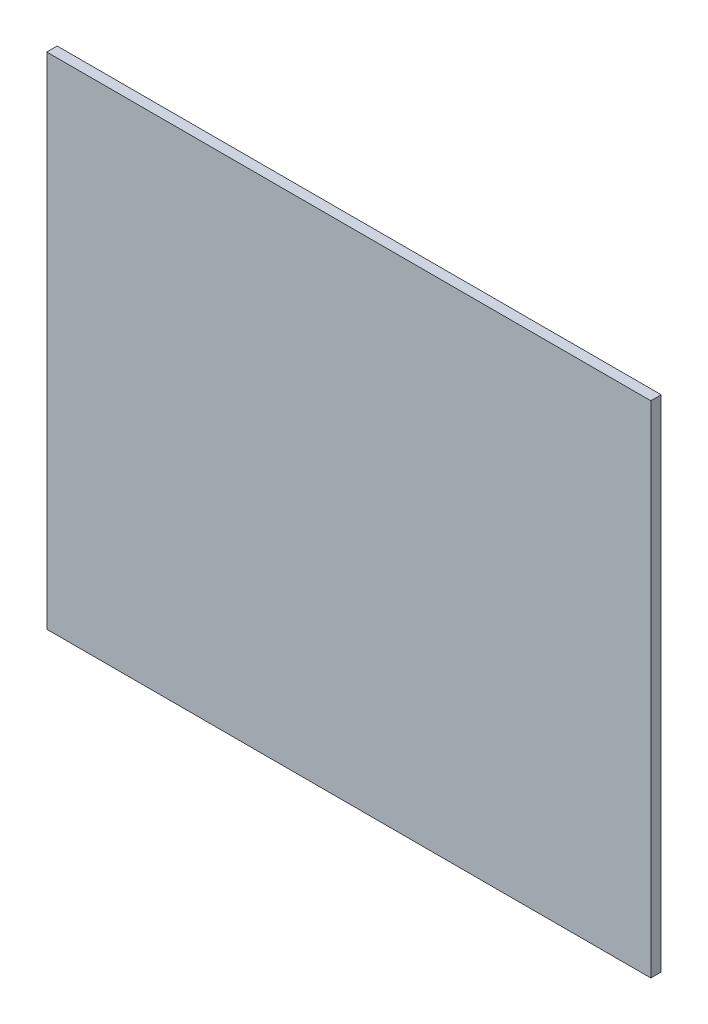
from build123d import *

# Parameters (mm, degrees)
SKETCH_1_W      = 29
SKETCH_1_H      = 24
EXTRUDE_1_DEPTH = 0.5


with BuildPart() as part:
    # 草图1 → 凸台-拉伸1 (new body)
    with BuildSketch(Plane.XY):
        with Locations((-14.5, 12)):
            Rectangle(SKETCH_1_W, SKETCH_1_H)
    extrude(amount=EXTRUDE_1_DEPTH)


solid = part.part
